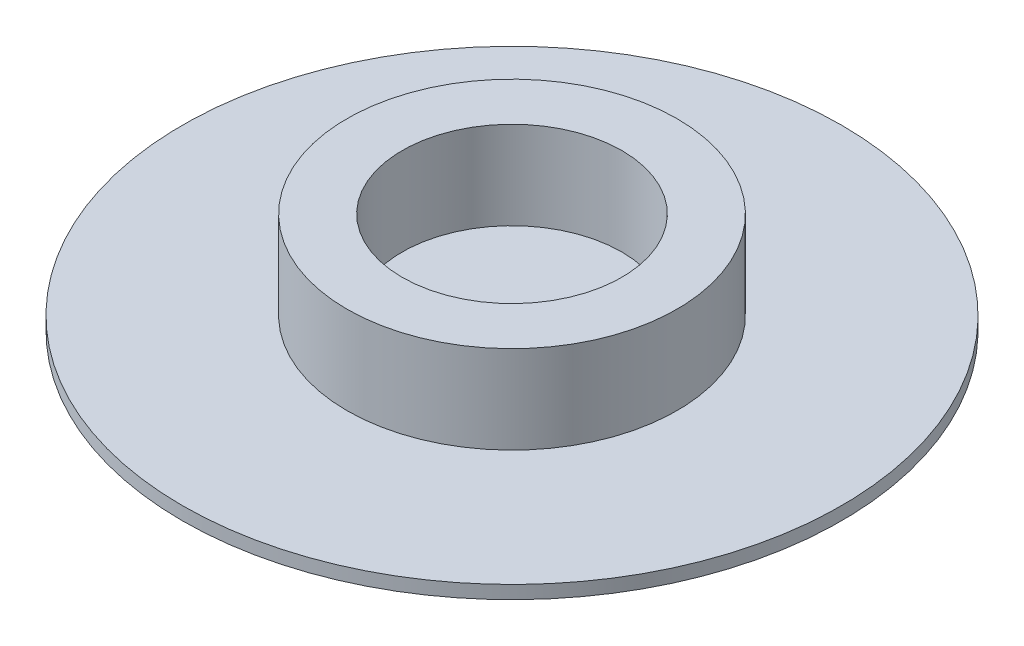
from build123d import *

# Parameters (mm, degrees)
SKETCH1_R           = 75
BOSS_EXTRUDE1_DEPTH = 3
SKETCH2_W           = 15
SKETCH2_H           = 50
D_N_B_NG_D_NH_DEPTH = 1
SKETCH3_R           = 37.559343171
SKETCH3_R_2         = 25
G_N_V_NG_BI_DEPTH   = 20


with BuildPart() as part:
    # Sketch1 → Boss-Extrude1 (new body)
    with BuildSketch(Plane(origin=(0, 0, 0), x_dir=(1, 0, 0), z_dir=(0, 1, 0))):
        with Locations(Location((0, 0, 0), (0, 0, 270))):
            Circle(SKETCH1_R)
    extrude(amount=BOSS_EXTRUDE1_DEPTH)

    # Sketch2 → Dán Băng dính (cut)
    with BuildSketch(Plane.XZ):
        with Locations((-40, 0)):
            Rectangle(SKETCH2_W, SKETCH2_H)
        with Locations((40, 0)):
            Rectangle(SKETCH2_W, SKETCH2_H)
    extrude(amount=-D_N_B_NG_D_NH_DEPTH, mode=Mode.SUBTRACT)

    # Sketch3 → gắn vòng bi (add)
    with BuildSketch(Plane(origin=(0, 3, 0), x_dir=(1, 0, 0), z_dir=(0, 1, 0))):
        with Locations(Location((0, 0, 0), (0, 0, 270))):
            Circle(SKETCH3_R)
        with Locations(Location((0, 0, 0), (0, 0, 270))):
            Circle(SKETCH3_R_2, mode=Mode.SUBTRACT)
    extrude(amount=G_N_V_NG_BI_DEPTH)


solid = part.part
